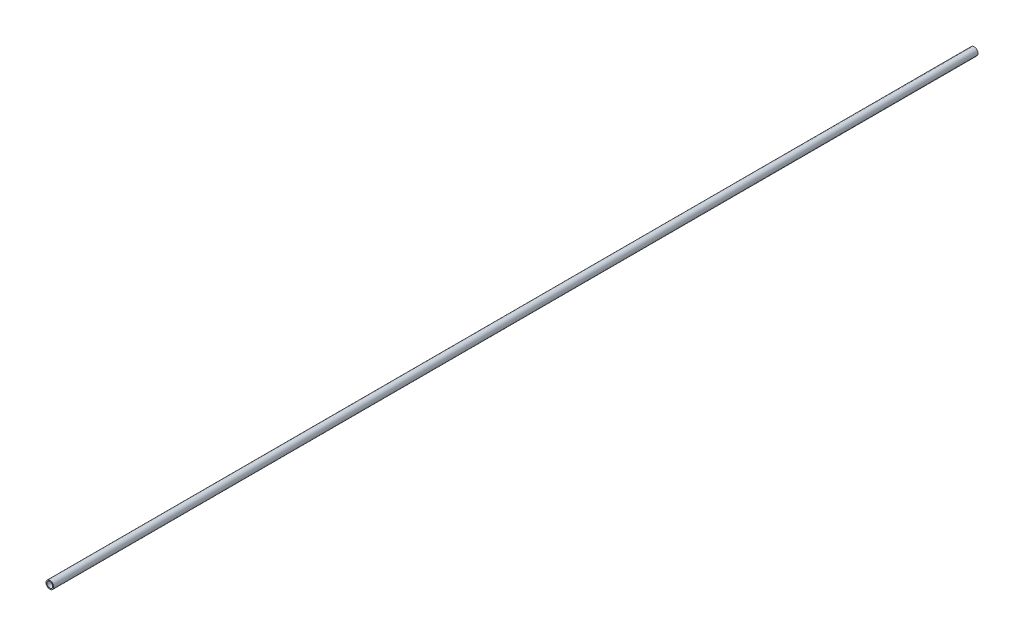
from build123d import *

# Parameters (mm, degrees)
SKETCH3_R           = 6.35
SKETCH3_R_2         = 4.7625
BOSS_EXTRUDE1_DEPTH = 762


with BuildPart() as part:
    # Sketch3 → Boss-Extrude1 (new, symmetric)
    with BuildSketch(Plane.XY):
        Circle(SKETCH3_R)
        Circle(SKETCH3_R_2, mode=Mode.SUBTRACT)
    extrude(amount=BOSS_EXTRUDE1_DEPTH, both=True)


solid = part.part
